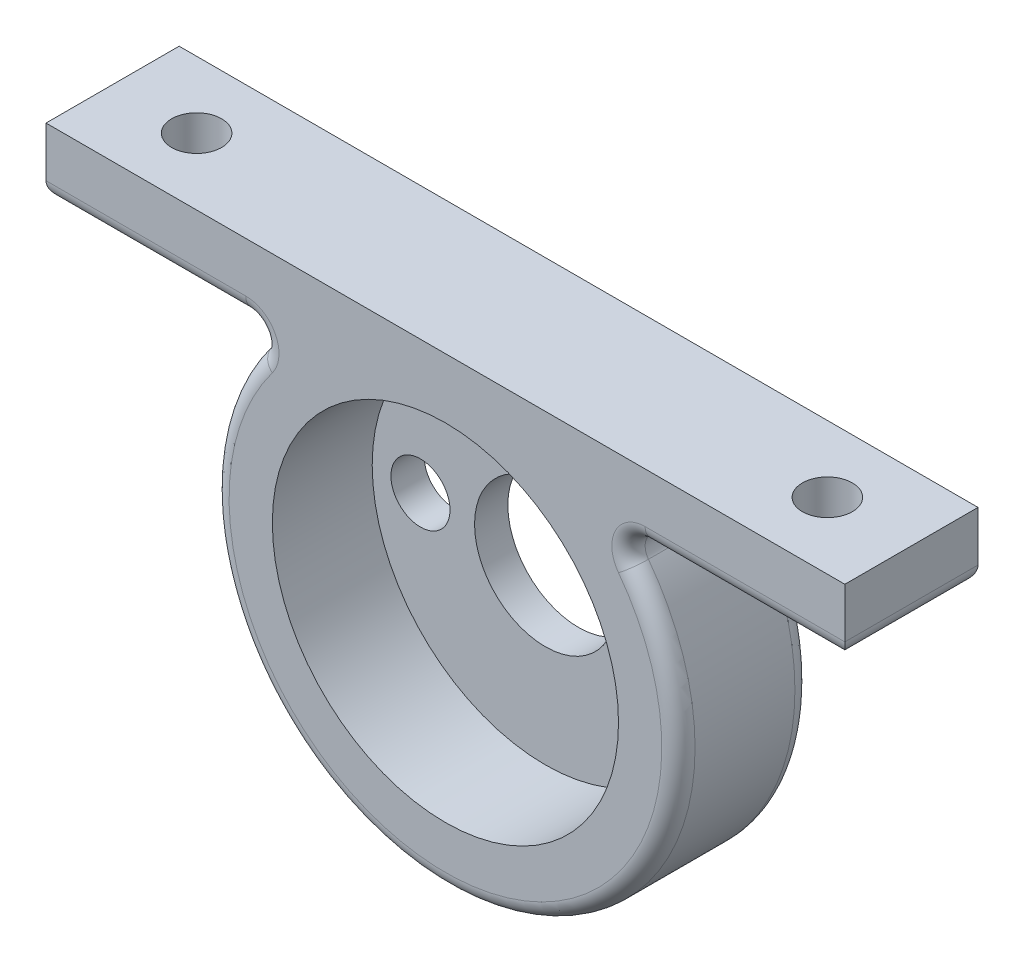
from build123d import *

# Parameters (mm, degrees)
SALIENTE_EXTRUIR1_DEPTH = 8
REDONDEO1_R             = 1
CROQUIS2_R              = 1.5
CORTAR_EXTRUIR1_DEPTH   = 35.871191617
CROQUIS3_R              = 10.4
CORTAR_EXTRUIR2_DEPTH   = 6
CROQUIS4_R              = 4.25
CROQUIS4_R_2            = 1.775
CORTAR_EXTRUIR3_DEPTH   = 29.913664638


with BuildPart() as part:
    # Croquis1 → Saliente-Extruir1 (new body)
    with BuildSketch(Plane.XY):
        with BuildLine():
            Line((0, 14), (24, 14))
            Line((24, 14), (24, 10))
            Line((24, 10), (9.797958971, 10))
            ThreePointArc((9.797958971, 10), (0, -14), (-9.797958971, 10))
            Line((-9.797958971, 10), (-24, 10))
            Line((-24, 10), (-24, 14))
            Line((-24, 14), (0, 14))
        make_face()
    extrude(amount=SALIENTE_EXTRUIR1_DEPTH)

    # Redondeo1
    redondeo1_edges = [part.edges().sort_by_distance(p)[0] for p in [
        (-9.797958971, 10, 4),
        (-24, 10, 4),
        (24, 10, 4),
        (9.797958971, 10, 4),
        (-16.898979486, 10, 8),
        (0, -14, 8),
        (-16.898979486, 10, 0),
        (16.898979486, 10, 8),
        (16.898979486, 10, 0),
        (0, -14, 0),
    ]]
    fillet(redondeo1_edges, radius=REDONDEO1_R)

    # Croquis2 → Cortar-Extruir1 (cut, through all)
    with BuildSketch(Plane.XZ.offset(-10)):
        with Locations(Location((-18.949489743, 4, 0), (0, 0, 270))):
            Circle(CROQUIS2_R)
        with Locations(Location((18.949489743, 4, 0), (0, 0, 270))):
            Circle(CROQUIS2_R)
    extrude(amount=-CORTAR_EXTRUIR1_DEPTH, mode=Mode.SUBTRACT)

    # Croquis3 → Cortar-Extruir2 (cut)
    with BuildSketch(Plane.XY.offset(8)):
        Circle(CROQUIS3_R)
    extrude(amount=-CORTAR_EXTRUIR2_DEPTH, mode=Mode.SUBTRACT)

    # Croquis4 → Cortar-Extruir3 (cut, through all)
    with BuildSketch(Plane(origin=(0, 0, 0), x_dir=(-1, 0, 0), z_dir=(0, 0, -1))):
        Circle(CROQUIS4_R)
        with Locations((7.5, 0)):
            Circle(CROQUIS4_R_2)
        with Locations((-7.5, 0)):
            Circle(CROQUIS4_R_2)
    extrude(amount=-CORTAR_EXTRUIR3_DEPTH, mode=Mode.SUBTRACT)


solid = part.part
